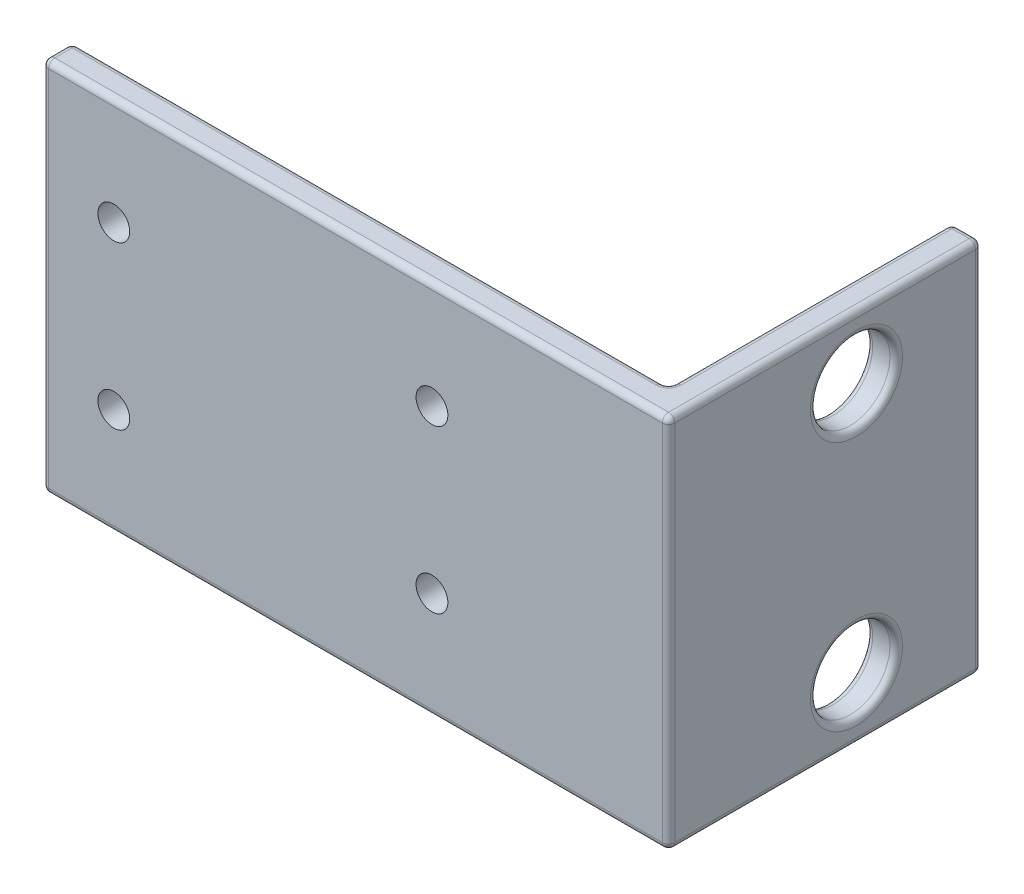
from build123d import *

# Parameters (mm, degrees)
BOSS_EXTRUDE1_DEPTH = 30
SKETCH2_R           = 1.27
CUT_EXTRUDE1_DEPTH  = 62.583645163
SKETCH3_R           = 3.175
CUT_EXTRUDE2_DEPTH  = 63.542848125
FILLET1_R           = 0.5


with BuildPart() as part:
    # Sketch1 → Boss-Extrude1 (new body)
    with BuildSketch(Plane(origin=(0, 0, 0), x_dir=(1, 0, 0), z_dir=(0, 1, 0))):
        Polygon((0, 0), (0, 22.61875), (2.38125, 22.61875), (2.38125, -2.38125), (-47.61875, -2.38125), (-47.61875, 0), align=None)
    extrude(amount=BOSS_EXTRUDE1_DEPTH)

    # Sketch2 → Cut-Extrude1 (cut, through all)
    with BuildSketch(Plane.XY.offset(2.38125)):
        with Locations((-41.91, 8.523)):
            Circle(SKETCH2_R)
        with Locations((-16.51, 8.523)):
            Circle(SKETCH2_R)
        with Locations((-16.51, 21.477)):
            Circle(SKETCH2_R)
        with Locations((-41.91, 21.477)):
            Circle(SKETCH2_R)
    extrude(amount=-CUT_EXTRUDE1_DEPTH, mode=Mode.SUBTRACT)

    # Sketch3 → Cut-Extrude2 (cut, through all)
    with BuildSketch(Plane(origin=(2.38125, 0, 0), x_dir=(0, 0, -1), z_dir=(1, 0, 0))):
        with Locations((12.61875, 25)):
            Circle(SKETCH3_R)
        with Locations((12.61875, 5)):
            Circle(SKETCH3_R)
    extrude(amount=-CUT_EXTRUDE2_DEPTH, mode=Mode.SUBTRACT)

    # Fillet1
    fillet1_edges = [part.edges().sort_by_distance(p)[0] for p in [
        (0, 15, 0),
        (0, 15, -22.61875),
        (2.38125, 15, -22.61875),
        (2.38125, 15, 2.38125),
        (-47.61875, 15, 2.38125),
        (-47.61875, 15, 0),
        (-22.61875, 30, 2.38125),
        (2.38125, 30, -10.11875),
        (1.190625, 30, -22.61875),
        (-43.18, 21.477, 0),
        (0, 30, -11.309375),
        (-17.78, 21.477, 0),
        (-17.78, 8.523, 0),
        (-43.18, 8.523, 0),
        (0, 25, -9.44375),
        (2.38125, 25, -9.44375),
        (0, 5, -9.44375),
        (2.38125, 5, -9.44375),
        (-23.809375, 30, 0),
        (0, 0, -11.309375),
        (1.190625, 0, -22.61875),
        (2.38125, 0, -10.11875),
        (-22.61875, 0, 2.38125),
        (-47.61875, 0, 1.190625),
        (-23.809375, 0, 0),
        (-47.61875, 30, 1.190625),
    ]]
    fillet(fillet1_edges, radius=FILLET1_R)


solid = part.part
